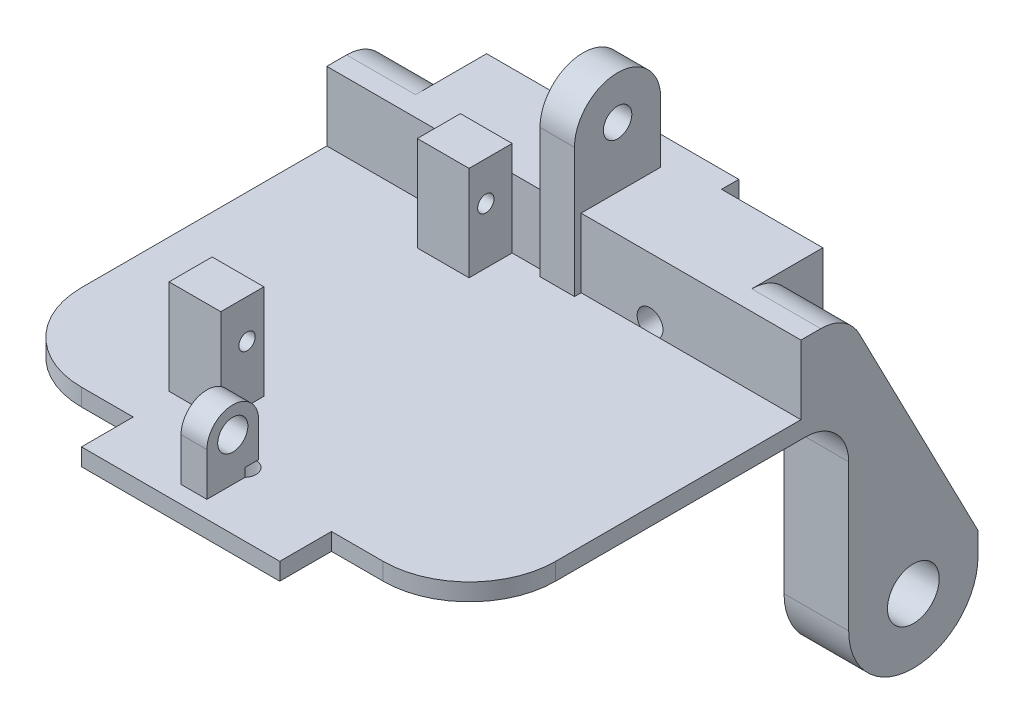
from build123d import *

# Parameters (mm, degrees)
SKETCH_1_W          = 55
SKETCH_1_H          = 39
EXTRUDE_1_DEPTH     = 2
SKETCH_2_W          = 23
SKETCH_2_H          = 6
EXTRUDE_2_DEPTH     = 2
SKETCH_3_W          = 6
SKETCH_3_H          = 5
EXTRUDE_3_DEPTH     = 11
SKETCH_5_R          = 0.95
CUT_EXTRUDE_1_DEPTH = 11
SKETCH_6_W          = 55
SKETCH_6_H          = 0.541458129
EXTRUDE_4_DEPTH     = 8
SKETCH_8_R          = 1.65
EXTRUDE_6_DEPTH     = 2
SKETCH_10_W         = 3
SKETCH_10_H         = 6
EXTRUDE_7_DEPTH     = 8
SKETCH_11_R         = 1.5
CUT_EXTRUDE_3_DEPTH = 13
SKETCH_12_R         = 3
EXTRUDE_8_DEPTH     = 7.5
SKETCH_13_W         = 10
SKETCH_13_H         = 3.7
EXTRUDE_9_DEPTH     = 1
FILLET_3_RADIUS     = 3
FILLET_3_LENGTH     = 3
SKETCH_15_R         = 1.75
CUT_EXTRUDE_5_DEPTH = 23
SKETCH_16_W         = 15.5
SKETCH_16_H         = 4
EXTRUDE_10_DEPTH    = 20
SKETCH_17_R         = 1.5
EXTRUDE_11_DEPTH    = 10
FILLET_4_R          = 10
SKETCH_18_W         = 26.564734734
SKETCH_18_H         = 10.454508508
CUT_EXTRUDE_6_DEPTH = 10
CUT_EXTRUDE_7_DEPTH = 8
CUT_EXTRUDE_8_DEPTH = 8
FILLET_6_R          = 5
SKETCH_21_R         = 1.4
CUT_EXTRUDE_9_DEPTH = 4
FILLET_7_R          = 10


with BuildPart() as part:
    # 草图1 → 凸台-拉伸1 (new body)
    with BuildSketch(Plane(origin=(0, 0, 0), x_dir=(1, 0, 0), z_dir=(0, 1, 0))):
        Rectangle(SKETCH_1_W, SKETCH_1_H)
    extrude(amount=EXTRUDE_1_DEPTH)

    # 草图2 → 凸台-拉伸2 (add)
    with BuildSketch(Plane(origin=(0, 2, 0), x_dir=(1, 0, 0), z_dir=(0, 1, 0))):
        with Locations((0, -22.5)):
            Rectangle(SKETCH_2_W, SKETCH_2_H)
    extrude(amount=-EXTRUDE_2_DEPTH)

    # 草图3 → 凸台-拉伸3 (add)
    with BuildSketch(Plane(origin=(0, 2, 0), x_dir=(1, 0, 0), z_dir=(0, 1, 0))):
        with Locations((-9, -12.341458129)):
            Rectangle(SKETCH_3_W, SKETCH_3_H)
        with Locations((-9, 16.458541871)):
            Rectangle(SKETCH_3_W, SKETCH_3_H)
    extrude(amount=EXTRUDE_3_DEPTH)

    # 草图5 → 切除-拉伸1 (cut)
    with BuildSketch(Plane.ZY.offset(12)):
        with Locations((-15.908541871, 8.5)):
            Circle(SKETCH_5_R)
        with Locations((11.791458129, 8.5)):
            Circle(SKETCH_5_R)
    extrude(amount=-CUT_EXTRUDE_1_DEPTH, mode=Mode.SUBTRACT)

    # 草图6 → 凸台-拉伸4 (add)
    with BuildSketch(Plane(origin=(0, 2, 0), x_dir=(1, 0, 0), z_dir=(0, 1, 0))):
        with Locations((0, 19.229270936)):
            Rectangle(SKETCH_6_W, SKETCH_6_H)
    extrude(amount=EXTRUDE_4_DEPTH)

    # 草图8 → 凸台-拉伸6 (add, symmetric)
    with BuildSketch(Plane(origin=(0, 0, 0), x_dir=(0, 0, -1), z_dir=(1, 0, 0))):
        with BuildLine():
            Line((28.189872998, 17), (28.189872998, 0))
            Line((28.189872998, 0), (18.189872998, 0))
            Line((18.189872998, 0), (18.189872998, 17))
            ThreePointArc((18.189872998, 17), (23.189872998, 22), (28.189872998, 17))
        make_face()
        with Locations((23.189872998, 17)):
            Circle(SKETCH_8_R, mode=Mode.SUBTRACT)
    extrude(amount=EXTRUDE_6_DEPTH, both=True)

    # 草图10 → 凸台-拉伸7 (add)
    with BuildSketch(Plane(origin=(0, 2, 0), x_dir=(1, 0, 0), z_dir=(0, 1, 0))):
        with Locations((-0.45, -20.5)):
            Rectangle(SKETCH_10_W, SKETCH_10_H)
    extrude(amount=EXTRUDE_7_DEPTH)

    # 草图11 → 切除-拉伸3 (cut)
    with BuildSketch(Plane.XY.offset(-18.958541871)):
        with Locations((-10, 3)):
            Circle(SKETCH_11_R)
    cut_extrude_3 = extrude(amount=-CUT_EXTRUDE_3_DEPTH, mode=Mode.SUBTRACT)

    # 草图12 → 凸台-拉伸8 (add)
    with BuildSketch(Plane.ZY.offset(27.5)):
        with BuildLine():
            Line((-39.5, -22), (-39.5, 10))
            Line((-39.5, 10), (-19.5, 10))
            Line((-19.5, 10), (-19.5, 0))
            Line((-19.5, 0), (-24.5, 0))
            Line((-24.5, 0), (-24.5, -22))
            ThreePointArc((-24.5, -22), (-32, -29.5), (-39.5, -22))
        make_face()
        with Locations((-32, -22)):
            Circle(SKETCH_12_R, mode=Mode.SUBTRACT)
    extrude_8 = extrude(amount=-EXTRUDE_8_DEPTH)

    # 草图13 → 凸台-拉伸9 (add)
    with BuildSketch(Plane.XZ):
        with Locations((0, 18.15)):
            Rectangle(SKETCH_13_W, SKETCH_13_H)
    extrude(amount=EXTRUDE_9_DEPTH)

    # 镜向1: 切除-拉伸3, 凸台-拉伸8 across plane
    add(cut_extrude_3.mirror(Plane(origin=(0, 0, 0), x_dir=(0, 0, 1), z_dir=(1, 0, 0))), mode=Mode.SUBTRACT)
    add(extrude_8.mirror(Plane(origin=(0, 0, 0), x_dir=(0, 0, 1), z_dir=(1, 0, 0))))

    # 圆角3: full round fillet: the end face becomes a half cylinder, R = half its width
    fillet_3_face = Plane((-0.45, 10, 20.5), x_dir=(1, 0, 0), z_dir=(0, 1, 0))  # on the end face: x along it, z out of the body
    fillet_3_slab = fillet_3_face.offset(-FILLET_3_RADIUS / 2) * Box(FILLET_3_LENGTH, 2 * FILLET_3_RADIUS, FILLET_3_RADIUS, mode=Mode.PRIVATE)  # the body's end, R deep
    fillet_3_round = Plane((-0.45, 7, 20.5), x_dir=(0, 1, 0), z_dir=(1, 0, 0)) * Cylinder(FILLET_3_RADIUS, FILLET_3_LENGTH, mode=Mode.PRIVATE)  # its axis R under the face
    add(fillet_3_slab - fillet_3_round, mode=Mode.SUBTRACT)

    # 草图15 → 切除-拉伸5 (cut)
    with BuildSketch(Plane.ZY.offset(1.95)):
        with Locations((20.5, 7)):
            Circle(SKETCH_15_R)
    extrude(amount=-CUT_EXTRUDE_5_DEPTH, mode=Mode.SUBTRACT)

    # 草图16 → 凸台-拉伸10 (add)
    with BuildSketch(Plane(origin=(0, 0, -19.5), x_dir=(-1, 0, 0), z_dir=(0, 0, -1))):
        with Locations((0, 8)):
            Rectangle(SKETCH_16_W, SKETCH_16_H)
    extrude(amount=EXTRUDE_10_DEPTH)

    # 草图17 → 凸台-拉伸11 (add)
    # profile 1 of 2: a face of its own
    with BuildSketch(Plane(origin=(0, 0, -19.5), x_dir=(-1, 0, 0), z_dir=(0, 0, -1))):
        Polygon((-20, 0), (-2, 0), (-2, 6), (-7.75, 6), (-7.75, 10), (-20, 10), align=None)
        with Locations(Location((-10, 3, 0), (0, 0, 221.810314896))):
            Circle(SKETCH_17_R, mode=Mode.SUBTRACT)
    # profile 2 of 2: a face of its own
    with BuildSketch(Plane(origin=(0, 0, -19.5), x_dir=(-1, 0, 0), z_dir=(0, 0, -1))):
        Polygon((7.75, 6), (2, 6), (2, 0), (20, 0), (20, 10), (7.75, 10), align=None)
        with Locations(Location((10, 3, 0), (0, 0, 180))):
            Circle(SKETCH_17_R, mode=Mode.SUBTRACT)
    extrude(amount=EXTRUDE_11_DEPTH)

    # 圆角4
    fillet_4_edges = [part.edges().sort_by_distance(p)[0] for p in [
        (23.75, 10, -39.5),
        (-23.75, 10, -39.5),
    ]]
    fillet(fillet_4_edges, radius=FILLET_4_R)

    # 草图18 → 切除-拉伸6 (cut)
    with BuildSketch(Plane(origin=(0, 10, 0), x_dir=(1, 0, 0), z_dir=(0, 1, 0))):
        with Locations((-0.840887807, 36.727254254)):
            Rectangle(SKETCH_18_W, SKETCH_18_H)
    extrude(amount=-CUT_EXTRUDE_6_DEPTH, mode=Mode.SUBTRACT)

    # 草图19 → 切除-拉伸7 (cut)
    with BuildSketch(Plane(origin=(27.5, 0, 0), x_dir=(0, 0, -1), z_dir=(1, 0, 0))):
        Polygon((24.3, 10), (39.5, -19.395601839), (39.5, 10), align=None)
    extrude(amount=-CUT_EXTRUDE_7_DEPTH, mode=Mode.SUBTRACT)

    # 草图20 → 切除-拉伸8 (cut)
    with BuildSketch(Plane.ZY.offset(27.5)):
        Polygon((-24.3, 10), (-39.5, 10), (-39.5, -19.395601839), align=None)
    extrude(amount=-CUT_EXTRUDE_8_DEPTH, mode=Mode.SUBTRACT)

    # 圆角6
    fillet_6_edges = [part.edges().sort_by_distance(p)[0] for p in [
        (-23.75, 0, -24.5),
        (23.75, 0, -24.5),
        (23.5, 10, -24.3),
        (-23.5, 10, -24.3),
    ]]
    fillet(fillet_6_edges, radius=FILLET_6_R)

    # 草图21 → 切除-拉伸9 (cut)
    with BuildSketch(Plane.XZ.offset(1)):
        with Locations(Location((0, 18.15, 0), (0, 0, 270))):
            Circle(SKETCH_21_R)
    extrude(amount=-CUT_EXTRUDE_9_DEPTH, mode=Mode.SUBTRACT)

    # 圆角7
    fillet_7_edges = [part.edges().sort_by_distance(p)[0] for p in [
        (27.5, 1, 19.5),
        (-27.5, 1, 19.5),
    ]]
    fillet(fillet_7_edges, radius=FILLET_7_R)


solid = part.part
